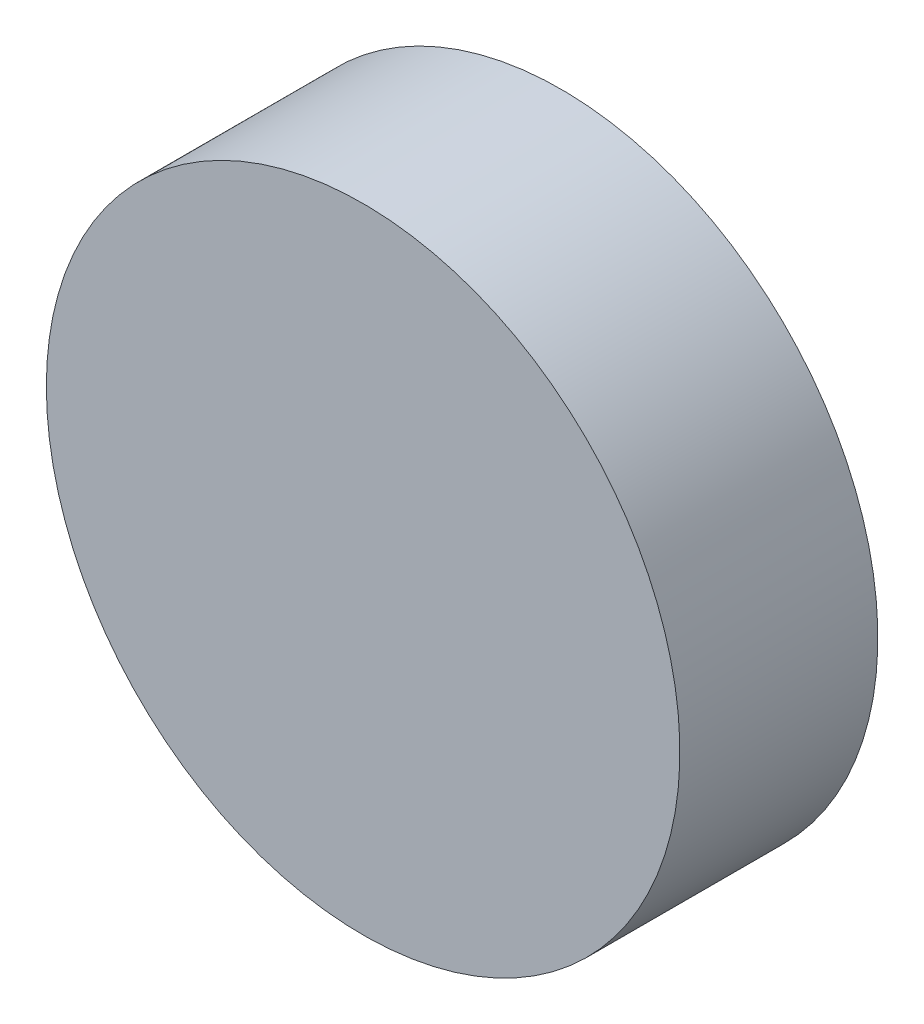
from build123d import *

# Parameters (mm, degrees)
CHAMFER_1_SIZE = 0.5


with BuildPart() as part:
    # Эскиз1 → Revolve 325 (revolve)
    with BuildSketch(Plane(origin=(0, 0, 0), x_dir=(1, 0, 0), z_dir=(0, 1, 0)), mode=Mode.PRIVATE) as revolve_325_sk:
        Polygon((0, 0), (8, 0), (8, 5), (3, 5), (3, 6), (2, 6), (2, 9), (0, 9), align=None)
    revolve(revolve_325_sk.sketch.rotate(Axis((0, 0, -9), (0, 0, 1)), 180), axis=Axis((0, 0, -9), (0, 0, 1)))

    # Фаска1
    chamfer_1_edges = [part.edges().sort_by_distance(p)[0] for p in [
        (2, 0, -9),
    ]]
    chamfer(chamfer_1_edges, length=CHAMFER_1_SIZE)


solid = part.part
